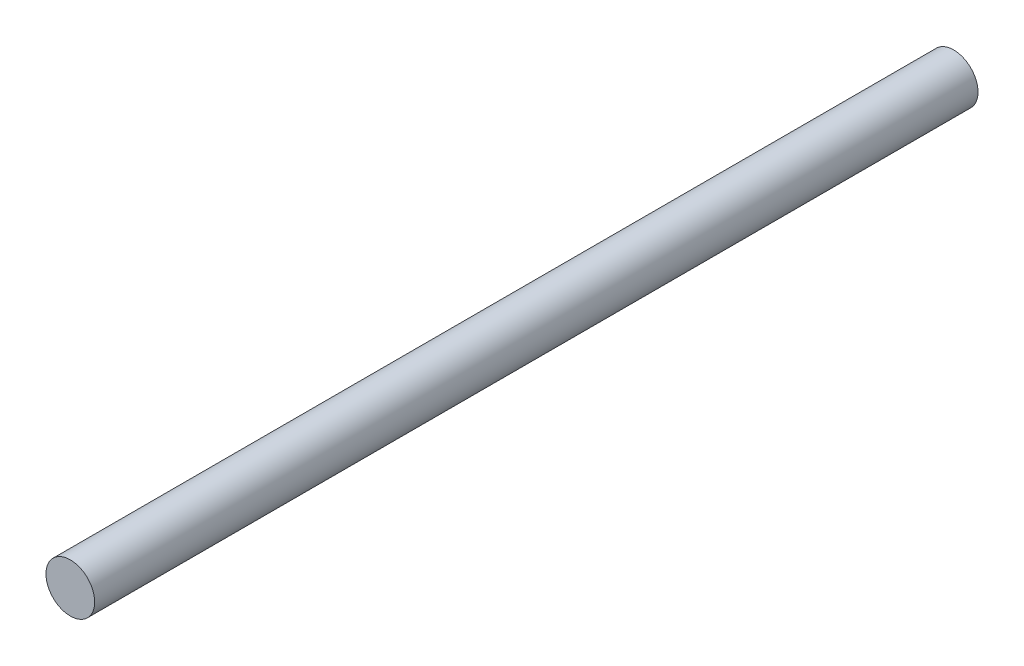
from build123d import *

# Parameters (mm, degrees)
SKETCH1_R           = 4
BOSS_EXTRUDE1_DEPTH = 72.5


with BuildPart() as part:
    # Sketch1 → Boss-Extrude1 (new, symmetric)
    with BuildSketch(Plane.XY):
        Circle(SKETCH1_R)
    extrude(amount=BOSS_EXTRUDE1_DEPTH, both=True)


solid = part.part
